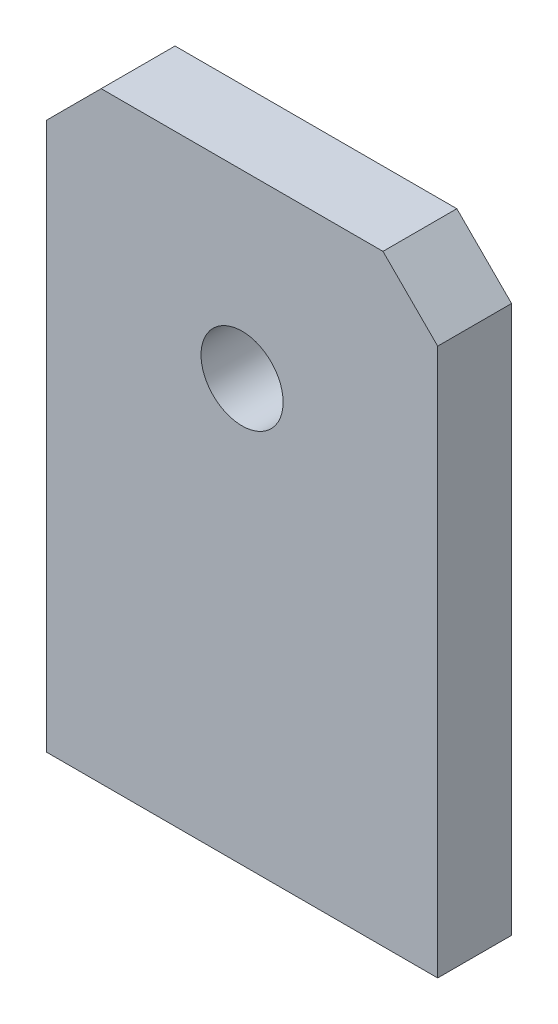
from build123d import *

# Parameters (mm, degrees)
SKETCH1_W           = 71.5
SKETCH1_H           = 110
SKETCH1_R           = 7.5
BOSS_EXTRUDE1_DEPTH = 13.5
CHAMFER1_SIZE       = 10
SKETCH2_R           = 4
CUT_EXTRUDE1_DEPTH  = 11


with BuildPart() as part:
    # Sketch1 → Boss-Extrude1 (new body)
    with BuildSketch(Plane.XY):
        with Locations((35.75, 55)):
            Rectangle(SKETCH1_W, SKETCH1_H)
        with Locations((35.75, 77)):
            Circle(SKETCH1_R, mode=Mode.SUBTRACT)
    extrude(amount=BOSS_EXTRUDE1_DEPTH)

    # Chamfer1
    chamfer1_edges = [part.edges().sort_by_distance(p)[0] for p in [
        (0, 110, 6.75),
        (71.5, 110, 6.75),
    ]]
    chamfer(chamfer1_edges, length=CHAMFER1_SIZE)

    # Sketch2 → Cut-Extrude1 (cut)
    with BuildSketch(Plane.XZ):
        with Locations((15.75, 6.75)):
            Circle(SKETCH2_R)
        with Locations((55.75, 6.75)):
            Circle(SKETCH2_R)
    extrude(amount=-CUT_EXTRUDE1_DEPTH, mode=Mode.SUBTRACT)


solid = part.part
